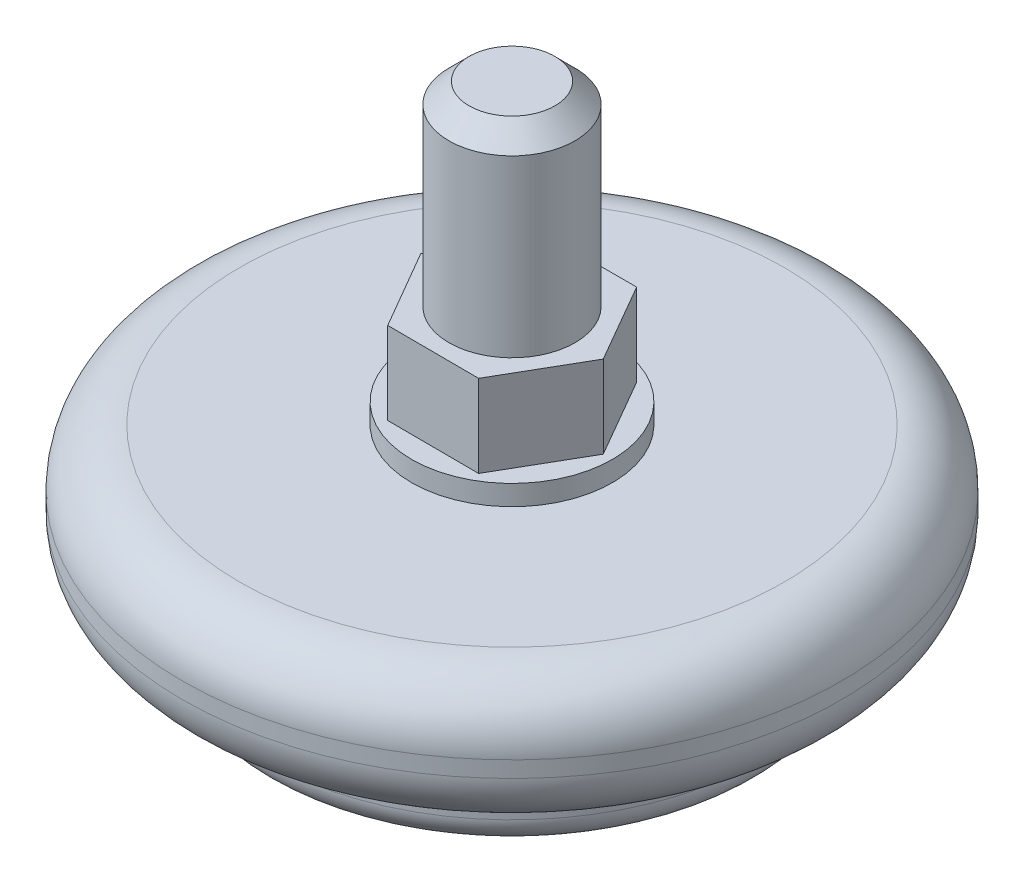
from build123d import *

# Parameters (mm, degrees)
SKETCH2_OUTSIDE_W  = 67.698
SKETCH2_OUTSIDE_H  = 67.698
CUT_EXTRUDE1_DEPTH = 6.223


with BuildPart() as part:
    # Sketch1 → Revolve1 (revolve)
    with BuildSketch(Plane.XY, mode=Mode.PRIVATE) as revolve1_sk:
        with BuildLine():
            Line((9.373695388, -16.129), (26.106953114, -16.129))
            Line((26.106953114, -16.129), (26.106953114, 20.955))
            Line((26.106953114, 20.955), (22.868453114, 20.955))
            Line((22.868453114, 20.955), (21.344453114, 19.431))
            Line((21.344453114, 19.431), (21.344453114, 6.223))
            Line((21.344453114, 6.223), (19.214545601, 6.223))
            Line((19.214545601, 6.223), (19.214545601, 0))
            Line((19.214545601, 0), (18.525304849, 0))
            Line((18.525304849, 0), (18.525304849, -1.524))
            Line((18.525304849, -1.524), (5.532953114, -1.524))
            ThreePointArc((5.532953114, -1.524), (2.479666033, -2.788712919), (1.214953114, -5.842))
            Line((1.214953114, -5.842), (1.214953114, -7.0612))
            ThreePointArc((1.214953114, -7.0612), (2.479666033, -10.114487081), (5.532953114, -11.3792))
            Line((5.532953114, -11.3792), (7.341695388, -11.3792))
            Line((7.341695388, -11.3792), (7.341695388, -14.097))
            ThreePointArc((7.341695388, -14.097), (7.936854408, -15.533840979), (9.373695388, -16.129))
        make_face()
    revolve(revolve1_sk.sketch.rotate(Axis((26.106953114, 20.955, 0), (0, -1, 0)), 270), axis=Axis((26.106953114, 20.955, 0), (0, -1, 0)))

    # Sketch2 outside → Cut-Extrude1 (cut)
    with BuildSketch(Plane(origin=(0, 6.223, 0), x_dir=(1, 0, 0), z_dir=(0, 1, 0))):
        with Locations((26.107, 0)):
            Rectangle(SKETCH2_OUTSIDE_W, SKETCH2_OUTSIDE_H)
        Polygon((22.660749357, 5.969), (29.553156871, 5.969), (32.999360628, 0), (29.553156871, -5.969), (22.660749357, -5.938392769), (19.214545601, 0), align=None, mode=Mode.SUBTRACT)
    extrude(amount=-CUT_EXTRUDE1_DEPTH, mode=Mode.SUBTRACT)


solid = part.part
